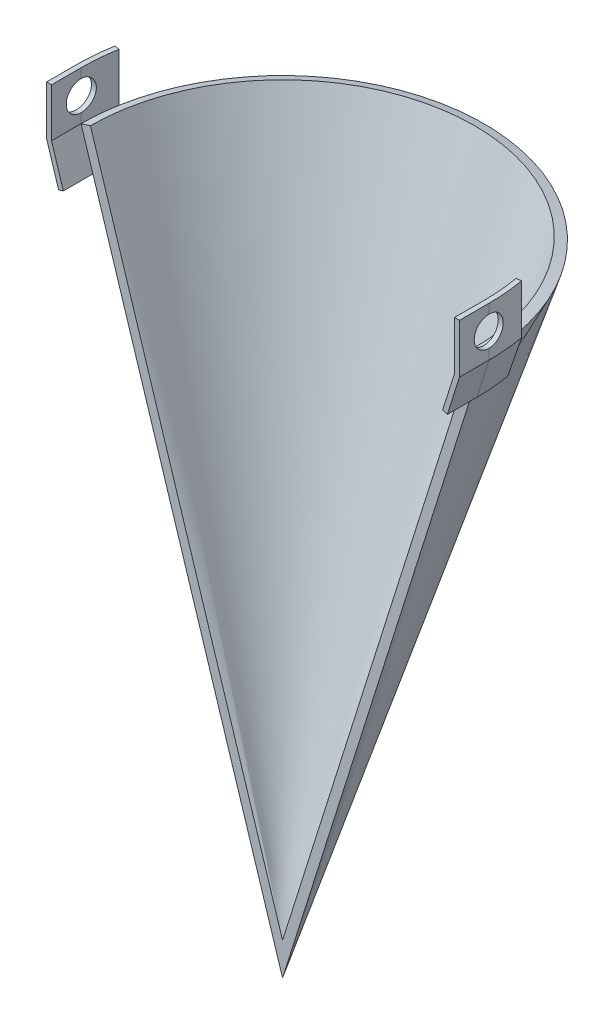
from build123d import *

# Parameters (mm, degrees)
REVOLUCI_N1_ANGLE       = 180
REVOLUCI_N2_ANGLE       = 10
SALIENTE_EXTRUIR1_DEPTH = 6
CORTAR_EXTRUIR1_START   = -167.998723797
CROQUIS4_R              = 3
CORTAR_EXTRUIR1_DEPTH   = 173.998723797


with BuildPart() as part:
    # Croquis1 → Revolución1 (revolve)
    with BuildSketch(Plane.XY):
        Polygon((0, 0), (0, 6.651019047), (39.028344285, 130.433112926), (40.935778186, 129.831701327), align=None)
    revolve(axis=Axis((0, 0, 0), (0, 1, 0)), revolution_arc=REVOLUCI_N1_ANGLE)

    # Croquis2 → Revolución2 (revolve)
    with BuildSketch(Plane.XY):
        Polygon((40.935778186, 129.831701327), (40.935778186, 139.677786606), (41.935778186, 139.677786606), (41.935778186, 129.677786606), (39.483848741, 121.901259921), (38.53013179, 122.201965721), align=None)
    revoluci_n2 = revolve(axis=Axis((0, 0, 0), (0, 1, 0)), revolution_arc=REVOLUCI_N2_ANGLE)

    # Croquis3 → Saliente-Extruir1 (add)
    with BuildSketch(Plane.XY):
        Polygon((40.935778186, 139.677786606), (41.935778186, 139.677786606), (41.935778186, 129.677786606), (39.483848741, 121.901259921), (38.53013179, 122.201965721), (40.935778186, 129.831701327), align=None)
    saliente_extruir1 = extrude(amount=SALIENTE_EXTRUIR1_DEPTH)

    # Croquis4 → Cortar-Extruir1 (cut)
    with BuildSketch(Plane.ZY.offset(-40.935778186).offset(CORTAR_EXTRUIR1_START)):
        with Locations((0, 134.754743966)):
            Circle(CROQUIS4_R)
    cortar_extruir1 = extrude(amount=CORTAR_EXTRUIR1_DEPTH, mode=Mode.SUBTRACT)

    # Simetría1: Revolución2, Saliente-Extruir1, Cortar-Extruir1 across plane
    add(revoluci_n2.mirror(Plane(origin=(0, 0, 0), x_dir=(0, 0, 1), z_dir=(1, 0, 0))))
    add(saliente_extruir1.mirror(Plane(origin=(0, 0, 0), x_dir=(0, 0, 1), z_dir=(1, 0, 0))))
    add(cortar_extruir1.mirror(Plane(origin=(0, 0, 0), x_dir=(0, 0, 1), z_dir=(1, 0, 0))), mode=Mode.SUBTRACT)


solid = part.part
